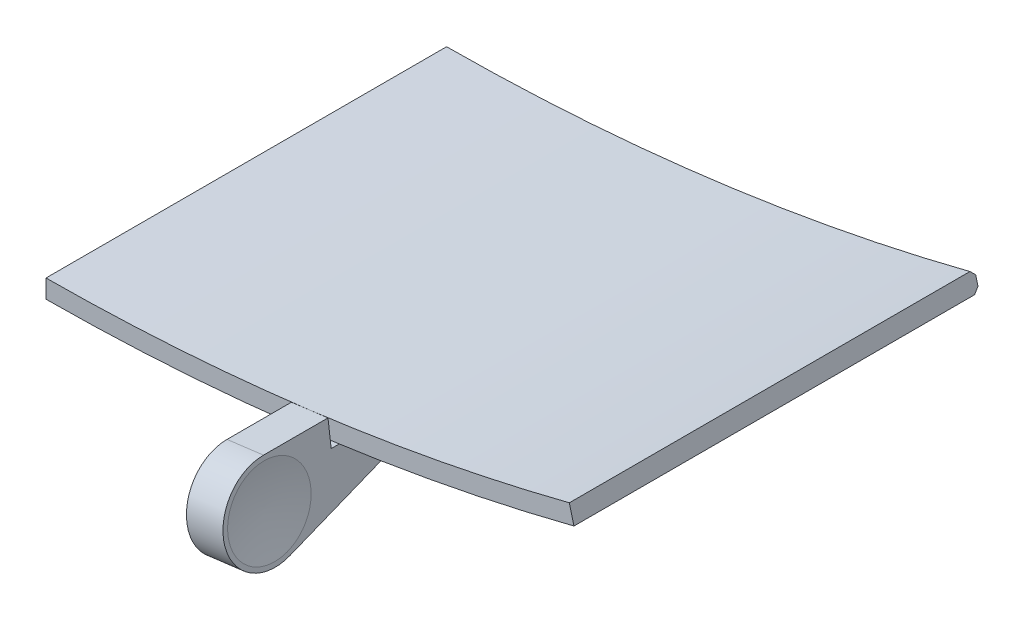
from build123d import *

# Parameters (mm, degrees)
EXTRUDE_1_DEPTH      = 44
CHAMFER_1_SIZE       = 0.5
CUT_EXTRUDE_1_DEPTH  = 249.332717862
EXTRUDE_3_DEPTH      = 2
EXTRUDE_3_DEPTH_BACK = 2


with BuildPart() as part:
    # 草图1 → 凸台-拉伸1 (new body)
    with BuildSketch(Plane.XY):
        with BuildLine():
            Line((0, -235), (0, -237))
            ThreePointArc((0, -237), (30.093797613, -235.081609968), (59.700408378, -229.357496584))
            Line((59.700408378, -229.357496584), (59.196607464, -227.421990284))
            ThreePointArc((59.196607464, -227.421990284), (29.839841515, -233.097798914), (0, -235))
        make_face()
    extrude(amount=EXTRUDE_1_DEPTH)

    # 倒角1
    chamfer_1_edges = [part.edges().sort_by_distance(p)[0] for p in [
        (0, -236, 0),
        (30.093797613, -235.081609968, 0),
        (59.448507921, -228.389743434, 0),
        (29.839841515, -233.097798914, 0),
    ]]
    chamfer(chamfer_1_edges, length=CHAMFER_1_SIZE)

    # 草图4 → 切除-拉伸1 (cut, through all)
    with BuildSketch(Plane.XY.offset(44)):
        with BuildLine():
            Line((1.2, -234.99693615), (1.2, -236.996962006))
            ThreePointArc((1.2, -236.996962006), (0.600001923, -236.9992405), (0, -237))
            Line((0, -237), (0, -235))
            ThreePointArc((0, -235), (0.600001956, -234.999234036), (1.2, -234.99693615))
        make_face()
        with BuildLine():
            Line((59.700408378, -229.357496584), (59.196607464, -227.421990284))
            ThreePointArc((59.196607464, -227.421990284), (58.615760734, -227.572389787), (58.034531898, -227.721305783))
            Line((58.034531898, -227.721305783), (58.538339326, -229.656837105))
            ThreePointArc((58.538339326, -229.656837105), (59.119563309, -229.507902335), (59.700408378, -229.357496584))
        make_face()
    extrude(amount=-CUT_EXTRUDE_1_DEPTH, mode=Mode.SUBTRACT)

    # 草图5 → 凸台-拉伸3 (add, two sides: drawn at the far end of the back side and taken through both)
    with BuildSketch(Plane(origin=(0, 0, 0), x_dir=(0, 0, 1), z_dir=(-0.9919055272920719, -0.12697804899838705, 0)).offset(-EXTRUDE_3_DEPTH_BACK)):
        with BuildLine():
            Line((44, -235), (51, -235))
            ThreePointArc((51, -235), (55.931754955, -240.823281887), (49.37591019, -244.728882774))
            Line((49.37591019, -244.728882774), (29, -237.730970224))
            Line((29, -237.730970224), (44, -237.730970224))
            Line((44, -237.730970224), (44, -235))
        make_face()
    extrude(amount=EXTRUDE_3_DEPTH + EXTRUDE_3_DEPTH_BACK)

    # 草图6 → 切除-旋转2 (revolve, cut)
    with BuildSketch(Plane(origin=(30.47473176, -238.05732655, 0), x_dir=(-0.9919055272920719, -0.12697804899838705, 0), z_dir=(0.12697804899838705, -0.9919055272920719, 0))):
        with BuildLine():
            Line((-2, -51), (-2, -55.5))
            ThreePointArc((-2, -55.5), (-1.571903609, -53.267079519), (-1.4, -51))
            Line((-1.4, -51), (-2, -51))
        make_face()
        with BuildLine():
            Line((2, -51), (1.4, -51))
            ThreePointArc((1.4, -51), (1.571903609, -53.267079519), (2, -55.5))
            Line((2, -55.5), (2, -51))
        make_face()
    revolve(axis=Axis((28.490920705, -238.311282648, 51), (-0.9919055272920719, -0.12697804899838705, 0)), mode=Mode.SUBTRACT)


solid = part.part
